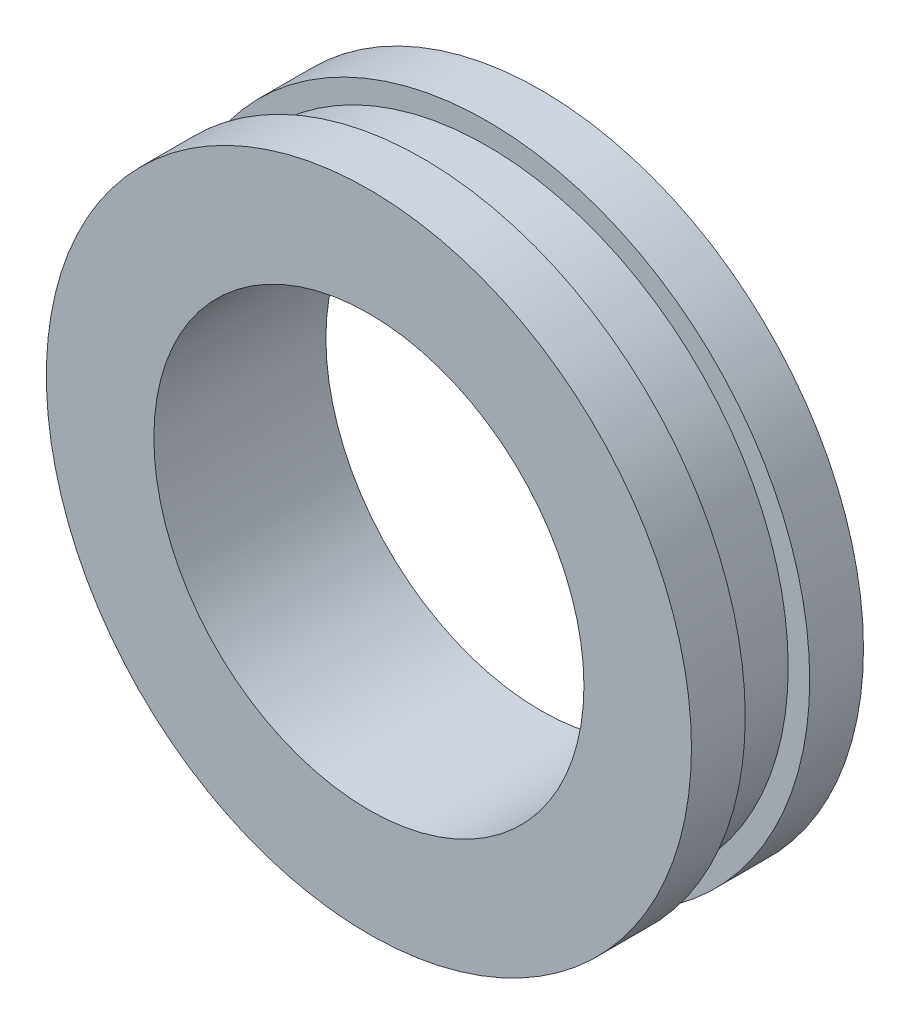
from build123d import *


with BuildPart() as part:
    # Croquis1 → Revolución1 (revolve)
    with BuildSketch(Plane(origin=(0, 0, 0), x_dir=(0, 0, -1), z_dir=(1, 0, 0)), mode=Mode.PRIVATE) as revoluci_n1_sk:
        Polygon((-2, 5), (2, 5), (2, 7.5), (0.75, 7.5), (0.75, 7), (-0.75, 7), (-0.75, 7.5), (-2, 7.5), align=None)
    revolve(revoluci_n1_sk.sketch.rotate(Axis((0, 0, 17.691339486), (0, 0, -1)), 90), axis=Axis((0, 0, 17.691339486), (0, 0, -1)))


solid = part.part
